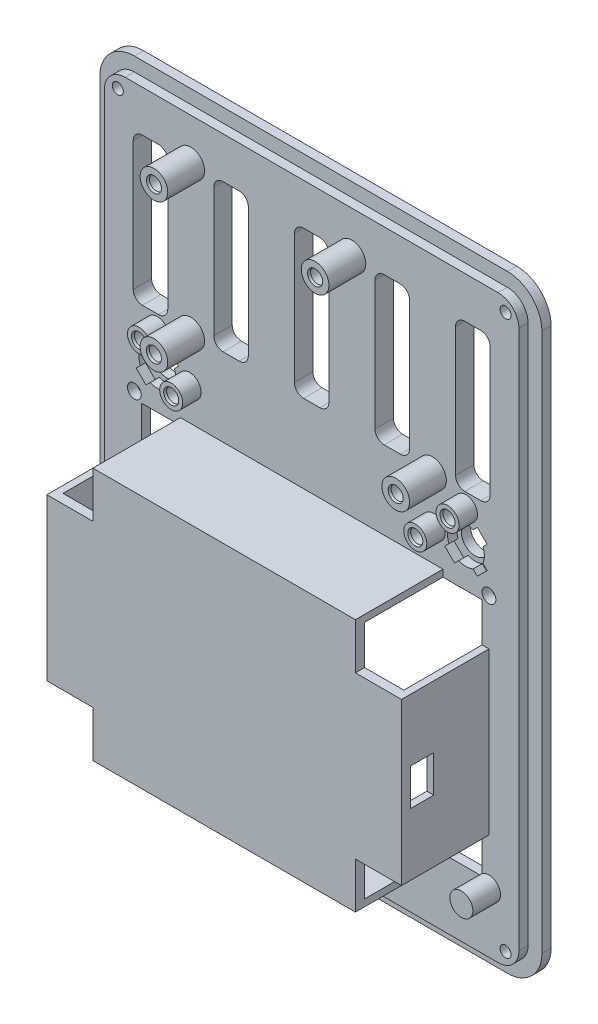
from build123d import *

# Parameters (mm, degrees)
BOSS_EXTRUDE1_DEPTH                              = 2
BOSS_EXTRUDE2_DEPTH                              = 2
CUT_EXTRUDE1_DEPTH                               = 82.706792863
CBORE_FOR_M2_PAN_HEAD_MACHINE_SCREW1_D           = 2.4
CBORE_FOR_M2_PAN_HEAD_MACHINE_SCREW1_CBORE_D     = 5
CBORE_FOR_M2_PAN_HEAD_MACHINE_SCREW1_CBORE_DEPTH = 1.6
BOSS_EXTRUDE3_START                              = -4
SKETCH8_3_W                                      = 77
SKETCH8_3_H                                      = 55
BOSS_EXTRUDE3_DEPTH                              = 19
SKETCH8_W                                        = 74
SKETCH8_H                                        = 52
CUT_EXTRUDE2_DEPTH                               = 21
SKETCH9_W                                        = 82
SKETCH9_H                                        = 60
CUT_EXTRUDE3_DEPTH                               = 2
CUT_EXTRUDE11_DEPTH                              = 5
CUT_EXTRUDE11_DEPTH_BACK                         = 84.791407674
SKETCH30_R                                       = 1.5
SKETCH15_W                                       = 5
SKETCH15_H                                       = 8
CUT_EXTRUDE4_DEPTH                               = 111.811777352
CUT_EXTRUDE5_DEPTH                               = 85.787970845
CUT_EXTRUDE7_DEPTH                               = 2
CUT_EXTRUDE7_DEPTH_BACK                          = 85.267431431
SKETCH17_R                                       = 3
CUT_EXTRUDE8_START                               = -2
SKETCH17_3_R                                     = 3
CUT_EXTRUDE8_DEPTH                               = 2
CUT_EXTRUDE9_START                               = -1
SKETCH16_3_W                                     = 13
SKETCH16_3_H                                     = 5.8
CUT_EXTRUDE9_DEPTH                               = 3
SKETCH21_R                                       = 2.5
BOSS_EXTRUDE6_DEPTH                              = 4
CSK_FOR_M2_FLAT_HEAD_MACHINE_SCREW5_AT_2_COUNT   = 2
CSK_FOR_M2_FLAT_HEAD_MACHINE_SCREW5_AT_2_PITCH   = 9.899494937
CSK_FOR_M2_FLAT_HEAD_MACHINE_SCREW5_AT_3_COUNT   = 2
CSK_FOR_M2_FLAT_HEAD_MACHINE_SCREW5_AT_3_PITCH   = 60.406953242
CSK_FOR_M2_FLAT_HEAD_MACHINE_SCREW5_AT_4_COUNT   = 2
CSK_FOR_M2_FLAT_HEAD_MACHINE_SCREW5_AT_4_PITCH   = 67
SKETCH27_R                                       = 3
BOSS_EXTRUDE7_DEPTH                              = 8
CSK_FOR_M2_FLAT_HEAD_MACHINE_SCREW6_D            = 3
CSK_FOR_M2_FLAT_HEAD_MACHINE_SCREW6_DEPTH        = 8
CSK_FOR_M2_FLAT_HEAD_MACHINE_SCREW6_CSINK_D      = 3.27
CSK_FOR_M2_FLAT_HEAD_MACHINE_SCREW6_CSINK_ANGLE  = 30
CUT_EXTRUDE12_REACH                              = 86.788
SKETCH31_W                                       = 10
SKETCH31_H                                       = 10
SKETCH10_R                                       = 2.5
BOSS_EXTRUDE8_DEPTH                              = 6
CSK_FOR_M2_FLAT_HEAD_MACHINE_SCREW2_D            = 3
CSK_FOR_M2_FLAT_HEAD_MACHINE_SCREW2_DEPTH        = 6
CSK_FOR_M2_FLAT_HEAD_MACHINE_SCREW2_CSINK_D      = 3.27
CSK_FOR_M2_FLAT_HEAD_MACHINE_SCREW2_CSINK_ANGLE  = 30
CSK_FOR_M2_FLAT_HEAD_MACHINE_SCREW2_TIP          = 0.901290929


with BuildPart() as part:
    # Sketch2 → Boss-Extrude1 (new body)
    with BuildSketch(Plane.XY):
        with BuildLine():
            Line((45, -58.5), (45, 58.5))
            ThreePointArc((45, 58.5), (43.681980515, 61.681980515), (40.5, 63))
            Line((40.5, 63), (-40.5, 63))
            ThreePointArc((-40.5, 63), (-43.681980515, 61.681980515), (-45, 58.5))
            Line((-45, 58.5), (-45, -58.5))
            ThreePointArc((-45, -58.5), (-43.681980515, -61.681980515), (-40.5, -63))
            Line((-40.5, -63), (40.5, -63))
            ThreePointArc((40.5, -63), (43.681980515, -61.681980515), (45, -58.5))
        make_face()
    extrude(amount=BOSS_EXTRUDE1_DEPTH)

    # Sketch3 → Boss-Extrude2 (add)
    with BuildSketch(Plane(origin=(0, 0, 0), x_dir=(-1, 0, 0), z_dir=(0, 0, -1))):
        with BuildLine():
            Line((-40.5, -66), (40.5, -66))
            ThreePointArc((40.5, -66), (45.803300859, -63.803300859), (48, -58.5))
            Line((48, -58.5), (48, 58.5))
            ThreePointArc((48, 58.5), (45.803300859, 63.803300859), (40.5, 66))
            Line((40.5, 66), (-40.5, 66))
            ThreePointArc((-40.5, 66), (-45.803300859, 63.803300859), (-48, 58.5))
            Line((-48, 58.5), (-48, -58.5))
            ThreePointArc((-48, -58.5), (-45.803300859, -63.803300859), (-40.5, -66))
        make_face()
    extrude(amount=BOSS_EXTRUDE2_DEPTH)

    # Sketch5 → Cut-Extrude1 (cut, through all)
    with BuildSketch(Plane(origin=(0, 0, -2), x_dir=(-1, 0, 0), z_dir=(0, 0, -1))):
        with BuildLine():
            Line((-36.75, 22), (-33.25, 22))
            ThreePointArc((-33.25, 22), (-31.835786438, 22.585786438), (-31.25, 24))
            Line((-31.25, 24), (-31.25, 52))
            ThreePointArc((-31.25, 52), (-31.835786438, 53.414213562), (-33.25, 54))
            Line((-33.25, 54), (-36.75, 54))
            ThreePointArc((-36.75, 54), (-38.164213562, 53.414213562), (-38.75, 52))
            Line((-38.75, 52), (-38.75, 24))
            ThreePointArc((-38.75, 24), (-38.164213562, 22.585786438), (-36.75, 22))
        make_face()
        with BuildLine():
            Line((-21.25, 24), (-21.25, 52))
            ThreePointArc((-21.25, 52), (-20.664213562, 53.414213562), (-19.25, 54))
            Line((-19.25, 54), (-15.75, 54))
            ThreePointArc((-15.75, 54), (-14.335786438, 53.414213562), (-13.75, 52))
            Line((-13.75, 52), (-13.75, 24))
            ThreePointArc((-13.75, 24), (-14.335786438, 22.585786438), (-15.75, 22))
            Line((-15.75, 22), (-19.25, 22))
            ThreePointArc((-19.25, 22), (-20.664213562, 22.585786438), (-21.25, 24))
        make_face()
        with BuildLine():
            Line((-3.75, 24), (-3.75, 52))
            ThreePointArc((-3.75, 52), (-3.164213562, 53.414213562), (-1.75, 54))
            Line((-1.75, 54), (1.75, 54))
            ThreePointArc((1.75, 54), (3.164213562, 53.414213562), (3.75, 52))
            Line((3.75, 52), (3.75, 24))
            ThreePointArc((3.75, 24), (3.164213562, 22.585786438), (1.75, 22))
            Line((1.75, 22), (-1.75, 22))
            ThreePointArc((-1.75, 22), (-3.164213562, 22.585786438), (-3.75, 24))
        make_face()
        with BuildLine():
            Line((13.75, 24), (13.75, 52))
            ThreePointArc((13.75, 52), (14.335786438, 53.414213562), (15.75, 54))
            Line((15.75, 54), (19.25, 54))
            ThreePointArc((19.25, 54), (20.664213562, 53.414213562), (21.25, 52))
            Line((21.25, 52), (21.25, 24))
            ThreePointArc((21.25, 24), (20.664213562, 22.585786438), (19.25, 22))
            Line((19.25, 22), (15.75, 22))
            ThreePointArc((15.75, 22), (14.335786438, 22.585786438), (13.75, 24))
        make_face()
        with BuildLine():
            Line((31.25, 24), (31.25, 52))
            ThreePointArc((31.25, 52), (31.835786438, 53.414213562), (33.25, 54))
            Line((33.25, 54), (36.75, 54))
            ThreePointArc((36.75, 54), (38.164213562, 53.414213562), (38.75, 52))
            Line((38.75, 52), (38.75, 24))
            ThreePointArc((38.75, 24), (38.164213562, 22.585786438), (36.75, 22))
            Line((36.75, 22), (33.25, 22))
            ThreePointArc((33.25, 22), (31.835786438, 22.585786438), (31.25, 24))
        make_face()
    extrude(amount=-CUT_EXTRUDE1_DEPTH, mode=Mode.SUBTRACT)

    # CBORE for M2 Pan Head Machine Screw1 (through all)
    with Locations(Plane(origin=(0, 0, -2), x_dir=(-1, 0, 0), z_dir=(0, 0, -1))):
        with Locations((-42.1, 60.1), (42.1, 60.1), (-42.1, -60.1), (42.1, -60.1)):
            CounterBoreHole(CBORE_FOR_M2_PAN_HEAD_MACHINE_SCREW1_D / 2, CBORE_FOR_M2_PAN_HEAD_MACHINE_SCREW1_CBORE_D / 2, CBORE_FOR_M2_PAN_HEAD_MACHINE_SCREW1_CBORE_DEPTH)

    # Sketch8<3> → Boss-Extrude3 (add)
    with BuildSketch(Plane(origin=(0, 0, -2), x_dir=(-1, 0, 0), z_dir=(0, 0, -1)).offset(BOSS_EXTRUDE3_START)):
        with Locations((0, -22.5)):
            Rectangle(SKETCH8_3_W, SKETCH8_3_H)
    extrude(amount=-BOSS_EXTRUDE3_DEPTH)

    # Sketch8 → Cut-Extrude2 (cut)
    with BuildSketch(Plane(origin=(0, 0, -2), x_dir=(-1, 0, 0), z_dir=(0, 0, -1))):
        with Locations((0, -22.5)):
            Rectangle(SKETCH8_W, SKETCH8_H)
    extrude(amount=-CUT_EXTRUDE2_DEPTH, mode=Mode.SUBTRACT)

    # Sketch9 → Cut-Extrude3 (cut)
    with BuildSketch(Plane(origin=(0, 0, -2), x_dir=(-1, 0, 0), z_dir=(0, 0, -1))):
        with Locations((0, -22.5)):
            Rectangle(SKETCH9_W, SKETCH9_H)
    extrude(amount=-CUT_EXTRUDE3_DEPTH, mode=Mode.SUBTRACT)

    # Sketch30 → Cut-Extrude11 (cut, two sides: drawn at the far end of the back side and taken through both)
    with BuildSketch(Plane.XY.offset(2).offset(-CUT_EXTRUDE11_DEPTH_BACK)):
        with Locations((-38.5, 5)):
            Circle(SKETCH30_R)
        with Locations(Location((38.5, 5, 0), (0, 0, 180))):
            Circle(SKETCH30_R)
    extrude(amount=CUT_EXTRUDE11_DEPTH + CUT_EXTRUDE11_DEPTH_BACK, mode=Mode.SUBTRACT)

    # Sketch15 → Cut-Extrude4 (cut, through all)
    with BuildSketch(Plane(origin=(38.5, 0, 0), x_dir=(0, 0, -1), z_dir=(1, 0, 0))):
        with Locations((-16.5, -22.5)):
            Rectangle(SKETCH15_W, SKETCH15_H)
    extrude(amount=-CUT_EXTRUDE4_DEPTH, mode=Mode.SUBTRACT)

    # Sketch16 → Cut-Extrude5 (cut, through all)
    with BuildSketch(Plane(origin=(0, 0, -2), x_dir=(-1, 0, 0), z_dir=(0, 0, -1))):
        with BuildLine():
            Line((2.515812527, -57.4), (-2.515812527, -57.4))
            ThreePointArc((-2.515812527, -57.4), (-2.727890225, -57.352794711), (-2.899923167, -57.2200922))
            Line((-2.899923167, -57.2200922), (-3.88411064, -56.039067232))
            ThreePointArc((-3.88411064, -56.039067232), (-3.970135789, -55.889187664), (-4, -55.718975032))
            Line((-4, -55.718975032), (-4, -54.9))
            ThreePointArc((-4, -54.9), (-3.853553391, -54.546446609), (-3.5, -54.4))
            Line((-3.5, -54.4), (3.5, -54.4))
            ThreePointArc((3.5, -54.4), (3.853553391, -54.546446609), (4, -54.9))
            Line((4, -54.9), (4, -55.718975032))
            ThreePointArc((4, -55.718975032), (3.970135789, -55.889187664), (3.88411064, -56.039067232))
            Line((3.88411064, -56.039067232), (2.899923167, -57.2200922))
            ThreePointArc((2.899923167, -57.2200922), (2.727890225, -57.352794711), (2.515812527, -57.4))
        make_face()
    extrude(amount=-CUT_EXTRUDE5_DEPTH, mode=Mode.SUBTRACT)

    # Sketch17 → Cut-Extrude7 (cut, two sides: drawn at the far end of the back side and taken through both)
    with BuildSketch(Plane(origin=(0, 0, 0), x_dir=(-1, 0, 0), z_dir=(0, 0, -1)).offset(-CUT_EXTRUDE7_DEPTH_BACK)):
        with Locations(Location((33.5, 12, 0), (0, 0, 180))):
            Circle(SKETCH17_R)
        with Locations(Location((-33.5, 12, 0), (0, 0, 180))):
            Circle(SKETCH17_R)
    extrude(amount=CUT_EXTRUDE7_DEPTH + CUT_EXTRUDE7_DEPTH_BACK, mode=Mode.SUBTRACT)

    # Sketch17<3> → Cut-Extrude8 (cut)
    # profile 1 of 2: a face of its own
    with BuildSketch(Plane(origin=(0, 0, 0), x_dir=(-1, 0, 0), z_dir=(0, 0, -1)).offset(CUT_EXTRUDE8_START)):
        with BuildLine():
            Line((-28.903805922, 9.525126266), (-29.817317708, 10.438638051))
            ThreePointArc((-29.817317708, 10.438638051), (-29.5, 12), (-29.817317708, 13.561361949))
            Line((-29.817317708, 13.561361949), (-28.903805922, 14.474873734))
            Line((-28.903805922, 14.474873734), (-31.025126266, 16.596194078))
            Line((-31.025126266, 16.596194078), (-31.938638051, 15.682682292))
            ThreePointArc((-31.938638051, 15.682682292), (-33.5, 16), (-35.061361949, 15.682682292))
            Line((-35.061361949, 15.682682292), (-35.974873734, 16.596194078))
            Line((-35.974873734, 16.596194078), (-38.096194078, 14.474873734))
            Line((-38.096194078, 14.474873734), (-37.182682292, 13.561361949))
            ThreePointArc((-37.182682292, 13.561361949), (-37.5, 12), (-37.182682292, 10.438638051))
            Line((-37.182682292, 10.438638051), (-38.096194078, 9.525126266))
            Line((-38.096194078, 9.525126266), (-35.974873734, 7.403805922))
            Line((-35.974873734, 7.403805922), (-35.061361949, 8.317317708))
            ThreePointArc((-35.061361949, 8.317317708), (-33.5, 8), (-31.938638051, 8.317317708))
            Line((-31.938638051, 8.317317708), (-31.025126266, 7.403805922))
            Line((-31.025126266, 7.403805922), (-28.903805922, 9.525126266))
        make_face()
        with Locations(Location((-33.5, 12, 0), (0, 0, 180))):
            Circle(SKETCH17_3_R, mode=Mode.SUBTRACT)
    # profile 2 of 2: a face of its own
    with BuildSketch(Plane(origin=(0, 0, 0), x_dir=(-1, 0, 0), z_dir=(0, 0, -1)).offset(CUT_EXTRUDE8_START)):
        with BuildLine():
            Line((38.096194078, 9.525126266), (37.182682292, 10.438638051))
            ThreePointArc((37.182682292, 10.438638051), (37.5, 12), (37.182682292, 13.561361949))
            Line((37.182682292, 13.561361949), (38.096194078, 14.474873734))
            Line((38.096194078, 14.474873734), (35.974873734, 16.596194078))
            Line((35.974873734, 16.596194078), (35.061361949, 15.682682292))
            ThreePointArc((35.061361949, 15.682682292), (33.5, 16), (31.938638051, 15.682682292))
            Line((31.938638051, 15.682682292), (31.025126266, 16.596194078))
            Line((31.025126266, 16.596194078), (28.903805922, 14.474873734))
            Line((28.903805922, 14.474873734), (29.817317708, 13.561361949))
            ThreePointArc((29.817317708, 13.561361949), (29.5, 12), (29.817317708, 10.438638051))
            Line((29.817317708, 10.438638051), (28.903805922, 9.525126266))
            Line((28.903805922, 9.525126266), (31.025126266, 7.403805922))
            Line((31.025126266, 7.403805922), (31.938638051, 8.317317708))
            ThreePointArc((31.938638051, 8.317317708), (33.5, 8), (35.061361949, 8.317317708))
            Line((35.061361949, 8.317317708), (35.974873734, 7.403805922))
            Line((35.974873734, 7.403805922), (38.096194078, 9.525126266))
        make_face()
        with Locations(Location((33.5, 12, 0), (0, 0, 180))):
            Circle(SKETCH17_3_R, mode=Mode.SUBTRACT)
    extrude(amount=CUT_EXTRUDE8_DEPTH, mode=Mode.SUBTRACT)

    # Sketch16<3> → Cut-Extrude9 (cut)
    with BuildSketch(Plane(origin=(0, 0, -2), x_dir=(-1, 0, 0), z_dir=(0, 0, -1)).offset(CUT_EXTRUDE9_START)):
        with Locations((0, -56.3)):
            Rectangle(SKETCH16_3_W, SKETCH16_3_H)
        with BuildLine():
            Line((2.515812527, -57.4), (-2.515812527, -57.4))
            ThreePointArc((-2.515812527, -57.4), (-2.727890225, -57.352794711), (-2.899923167, -57.2200922))
            Line((-2.899923167, -57.2200922), (-3.88411064, -56.039067232))
            ThreePointArc((-3.88411064, -56.039067232), (-3.970135789, -55.889187664), (-4, -55.718975032))
            Line((-4, -55.718975032), (-4, -54.9))
            ThreePointArc((-4, -54.9), (-3.853553391, -54.546446609), (-3.5, -54.4))
            Line((-3.5, -54.4), (3.5, -54.4))
            ThreePointArc((3.5, -54.4), (3.853553391, -54.546446609), (4, -54.9))
            Line((4, -54.9), (4, -55.718975032))
            ThreePointArc((4, -55.718975032), (3.970135789, -55.889187664), (3.88411064, -56.039067232))
            Line((3.88411064, -56.039067232), (2.899923167, -57.2200922))
            ThreePointArc((2.899923167, -57.2200922), (2.727890225, -57.352794711), (2.515812527, -57.4))
        make_face(mode=Mode.SUBTRACT)
    extrude(amount=-CUT_EXTRUDE9_DEPTH, mode=Mode.SUBTRACT)

    # Sketch21 → Boss-Extrude6 (add)
    with BuildSketch(Plane.XY.offset(2)):
        with Locations((-26.5, 12)):
            Circle(SKETCH21_R)
        with Locations((-33.5, 19)):
            Circle(SKETCH21_R)
        with Locations((26.5, 12)):
            Circle(SKETCH21_R)
        with Locations((33.5, 19)):
            Circle(SKETCH21_R)
    extrude(amount=BOSS_EXTRUDE6_DEPTH)

    # Sketch22 → CSK for M2 Flat Head Machine Screw5 (revolve, cut)
    with BuildSketch(Plane(origin=(-33.5, 19, 6), x_dir=(0, -1, 0), z_dir=(1, 0, 0))):
        Polygon((0, 0), (0, 4), (1.5, 4), (1.5, 0.503826859), (1.635, 0), align=None)
    csk_for_m2_flat_head_machine_screw5 = revolve(axis=Axis((-33.5, 19, 12.35), (0, 0, -1)), mode=Mode.SUBTRACT)

    # CSK for M2 Flat Head Machine Screw5 at 2: CSK for M2 Flat Head Machine Screw5 ×2
    with Locations(*[Vector(0.7071067811865478, -0.7071067811865474, 0) * (i * CSK_FOR_M2_FLAT_HEAD_MACHINE_SCREW5_AT_2_PITCH) for i in range(1, CSK_FOR_M2_FLAT_HEAD_MACHINE_SCREW5_AT_2_COUNT)]):
        add(csk_for_m2_flat_head_machine_screw5, mode=Mode.SUBTRACT)

    # CSK for M2 Flat Head Machine Screw5 at 3: CSK for M2 Flat Head Machine Screw5 ×2
    with Locations(*[Vector(0.993263139087243, -0.11588069956017834, 0) * (i * CSK_FOR_M2_FLAT_HEAD_MACHINE_SCREW5_AT_3_PITCH) for i in range(1, CSK_FOR_M2_FLAT_HEAD_MACHINE_SCREW5_AT_3_COUNT)]):
        add(csk_for_m2_flat_head_machine_screw5, mode=Mode.SUBTRACT)

    # CSK for M2 Flat Head Machine Screw5 at 4: CSK for M2 Flat Head Machine Screw5 ×2
    with Locations(*[(i * CSK_FOR_M2_FLAT_HEAD_MACHINE_SCREW5_AT_4_PITCH, 0, 0) for i in range(1, CSK_FOR_M2_FLAT_HEAD_MACHINE_SCREW5_AT_4_COUNT)]):
        add(csk_for_m2_flat_head_machine_screw5, mode=Mode.SUBTRACT)

    # Sketch27 → Boss-Extrude7 (add)
    with BuildSketch(Plane.XY.offset(2)):
        with Locations((-26.25, 54)):
            Circle(SKETCH27_R)
        with Locations((-26.25, 22)):
            Circle(SKETCH27_R)
        with Locations((8.75, 54)):
            Circle(SKETCH27_R)
        with Locations((26.25, 22)):
            Circle(SKETCH27_R)
    extrude(amount=BOSS_EXTRUDE7_DEPTH)

    # CSK for M2 Flat Head Machine Screw6
    with Locations(Plane.XY.offset(10)):
        with Locations((-26.25, 54), (8.75, 54), (-26.25, 22), (26.25, 22)):
            CounterSinkHole(CSK_FOR_M2_FLAT_HEAD_MACHINE_SCREW6_D / 2, CSK_FOR_M2_FLAT_HEAD_MACHINE_SCREW6_CSINK_D / 2, depth=CSK_FOR_M2_FLAT_HEAD_MACHINE_SCREW6_DEPTH, counter_sink_angle=CSK_FOR_M2_FLAT_HEAD_MACHINE_SCREW6_CSINK_ANGLE)

    # Cut-Extrude12: up to this face of the body (flat: up to its plane)
    cut_extrude12_end = Plane(part.part.faces().sort_by_distance((0.090255581, 8.663026614, 2))[0])
    # Sketch31 → Cut-Extrude12 (cut, up to the picked face)
    with BuildSketch(Plane.XY.offset(21), mode=Mode.PRIVATE) as cut_extrude12_sk1:
        with Locations((-33.5, 0)):
            Rectangle(SKETCH31_W, SKETCH31_H)
    cut_extrude12_tool1 = split(extrude(cut_extrude12_sk1.sketch, amount=-CUT_EXTRUDE12_REACH, mode=Mode.PRIVATE), bisect_by=cut_extrude12_end, keep=Keep.BOTH, mode=Mode.PRIVATE)
    # Sketch31 → Cut-Extrude12 (cut, up to the picked face)
    with BuildSketch(Plane.XY.offset(21), mode=Mode.PRIVATE) as cut_extrude12_sk2:
        with Locations((33.5, 0)):
            Rectangle(SKETCH31_W, SKETCH31_H)
    cut_extrude12_tool2 = split(extrude(cut_extrude12_sk2.sketch, amount=-CUT_EXTRUDE12_REACH, mode=Mode.PRIVATE), bisect_by=cut_extrude12_end, keep=Keep.BOTH, mode=Mode.PRIVATE)
    # Sketch31 → Cut-Extrude12 (cut, up to the picked face)
    with BuildSketch(Plane.XY.offset(21), mode=Mode.PRIVATE) as cut_extrude12_sk3:
        with Locations((-33.5, -45)):
            Rectangle(SKETCH31_W, SKETCH31_H)
    cut_extrude12_tool3 = split(extrude(cut_extrude12_sk3.sketch, amount=-CUT_EXTRUDE12_REACH, mode=Mode.PRIVATE), bisect_by=cut_extrude12_end, keep=Keep.BOTH, mode=Mode.PRIVATE)
    # Sketch31 → Cut-Extrude12 (cut, up to the picked face)
    with BuildSketch(Plane.XY.offset(21), mode=Mode.PRIVATE) as cut_extrude12_sk4:
        with Locations((33.5, -45)):
            Rectangle(SKETCH31_W, SKETCH31_H)
    cut_extrude12_tool4 = split(extrude(cut_extrude12_sk4.sketch, amount=-CUT_EXTRUDE12_REACH, mode=Mode.PRIVATE), bisect_by=cut_extrude12_end, keep=Keep.BOTH, mode=Mode.PRIVATE)
    add(cut_extrude12_tool1.solids().sort_by(Axis((-33.5, 0, 21), (0, 0, -1)))[0], mode=Mode.SUBTRACT)
    add(cut_extrude12_tool2.solids().sort_by(Axis((33.5, 0, 21), (0, 0, -1)))[0], mode=Mode.SUBTRACT)
    add(cut_extrude12_tool3.solids().sort_by(Axis((-33.5, -45, 21), (0, 0, -1)))[0], mode=Mode.SUBTRACT)
    add(cut_extrude12_tool4.solids().sort_by(Axis((33.5, -45, 21), (0, 0, -1)))[0], mode=Mode.SUBTRACT)

    # Sketch10 → Boss-Extrude8 (add)
    with BuildSketch(Plane.XY.offset(2)):
        with Locations(Location((-38.5, -50, 0), (0, 0, 53.130102354))):
            Circle(SKETCH10_R)
        with Locations(Location((38.5, -50, 0), (0, 0, 143.130102354))):
            Circle(SKETCH10_R)
    extrude(amount=BOSS_EXTRUDE8_DEPTH)

    # CSK for M2 Flat Head Machine Screw2
    with Locations(Plane(origin=(0, 0, 0), x_dir=(-1, 0, 0), z_dir=(0, 0, -1))):
        with Locations((-38.5, -50), (38.5, -50)):
            CounterSinkHole(CSK_FOR_M2_FLAT_HEAD_MACHINE_SCREW2_D / 2, CSK_FOR_M2_FLAT_HEAD_MACHINE_SCREW2_CSINK_D / 2, depth=CSK_FOR_M2_FLAT_HEAD_MACHINE_SCREW2_DEPTH, counter_sink_angle=CSK_FOR_M2_FLAT_HEAD_MACHINE_SCREW2_CSINK_ANGLE)
            with Locations((0, 0, -(CSK_FOR_M2_FLAT_HEAD_MACHINE_SCREW2_DEPTH + CSK_FOR_M2_FLAT_HEAD_MACHINE_SCREW2_TIP / 2))):  # 118° drill point
                Cone(0, CSK_FOR_M2_FLAT_HEAD_MACHINE_SCREW2_D / 2, CSK_FOR_M2_FLAT_HEAD_MACHINE_SCREW2_TIP, mode=Mode.SUBTRACT)


solid = part.part
